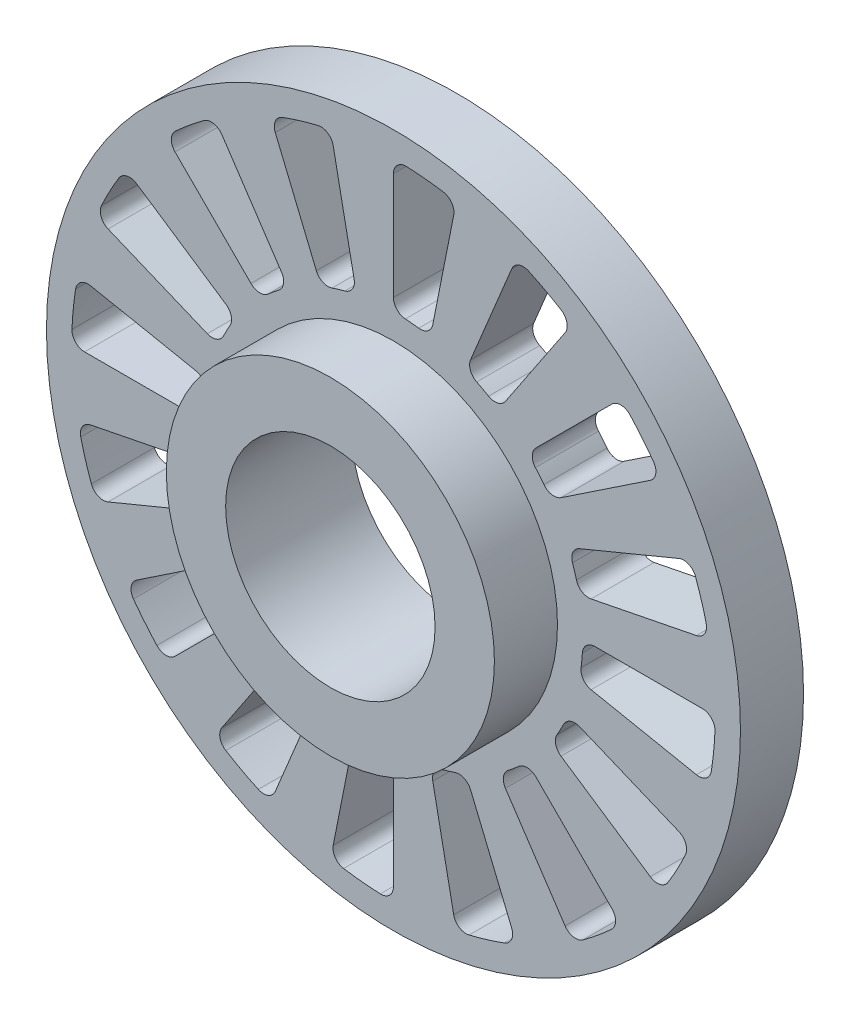
from build123d import *

# Parameters (mm, degrees)
SKETCH1_R                = 13.75
SKETCH1_R_2              = 4.15
BOSS_EXTRUDE1_DEPTH      = 2.5
SKETCH2_R                = 6.5
SKETCH2_R_2              = 4.15
BOSS_EXTRUDE2_DEPTH      = 2.5
CUT_EXTRUDE1_DEPTH       = 21.077973005
FILLET1_R                = 0.5
CIRPATTERN1_COUNT        = 16
FILLET1_OF_CIRPATTERN1_R = 0.5


with BuildPart() as part:
    # Sketch1 → Boss-Extrude1 (new body)
    with BuildSketch(Plane.XY):
        Circle(SKETCH1_R)
        Circle(SKETCH1_R_2, mode=Mode.SUBTRACT)
    extrude(amount=BOSS_EXTRUDE1_DEPTH)

    # Sketch2 → Boss-Extrude2 (add)
    with BuildSketch(Plane.XY.offset(2.5)):
        Circle(SKETCH2_R)
        Circle(SKETCH2_R_2, mode=Mode.SUBTRACT)
    extrude(amount=BOSS_EXTRUDE2_DEPTH)

    # Sketch5 → Cut-Extrude1 (cut, through all)
    with BuildSketch(Plane.XY):
        with BuildLine():
            Line((0, 12.75), (0, 7.5))
            ThreePointArc((0, 7.5), (0.735128552, 7.46388545), (1.463177415, 7.355889603))
            Line((1.463177415, 7.355889603), (2.487401606, 12.505012325))
            ThreePointArc((2.487401606, 12.505012325), (1.249718539, 12.688605265), (0, 12.75))
        make_face()
    cut_extrude1 = extrude(amount=CUT_EXTRUDE1_DEPTH, mode=Mode.SUBTRACT)

    # Fillet1
    fillet1_edges = [part.edges().sort_by_distance(p)[0] for p in [
        (0, 7.5, 1.25),
        (1.463177415, 7.355889603, 1.25),
        (2.487401606, 12.505012325, 1.25),
        (0, 12.75, 1.25),
    ]]
    fillet(fillet1_edges, radius=FILLET1_R)

    # CirPattern1: Cut-Extrude1 ×16 about axis
    cirpattern1_axis = Axis((0, 0, 0), (0, 0, 1))
    for i in range(1, CIRPATTERN1_COUNT):
        add(cut_extrude1.rotate(cirpattern1_axis, i * 360 / CIRPATTERN1_COUNT), mode=Mode.SUBTRACT)

    # Fillet1 of CirPattern1
    fillet1_of_cirpattern1_edges = [part.edges().sort_by_distance(p)[0] for p in [
        (-2.870125743, 6.929096494, 1.25),
        (-1.463177415, 7.355889603, 1.25),
        (-2.487401606, 12.505012325, 1.25),
        (-4.879213763, 11.77946404, 1.25),
        (-5.303300859, 5.303300859, 1.25),
        (-4.166776748, 6.236022092, 1.25),
        (-7.083520471, 10.601237557, 1.25),
        (-9.01561146, 9.01561146, 1.25),
        (-6.929096494, 2.870125743, 1.25),
        (-6.236022092, 4.166776748, 1.25),
        (-10.601237557, 7.083520471, 1.25),
        (-11.77946404, 4.879213763, 1.25),
        (-7.5, 0, 1.25),
        (-7.355889603, 1.463177415, 1.25),
        (-12.505012325, 2.487401606, 1.25),
        (-12.75, 0, 1.25),
        (-6.929096494, -2.870125743, 1.25),
        (-7.355889603, -1.463177415, 1.25),
        (-12.505012325, -2.487401606, 1.25),
        (-11.77946404, -4.879213763, 1.25),
        (-5.303300859, -5.303300859, 1.25),
        (-6.236022092, -4.166776748, 1.25),
        (-10.601237557, -7.083520471, 1.25),
        (-9.01561146, -9.01561146, 1.25),
        (-2.870125743, -6.929096494, 1.25),
        (-4.166776748, -6.236022092, 1.25),
        (-7.083520471, -10.601237557, 1.25),
        (-4.879213763, -11.77946404, 1.25),
        (0, -7.5, 1.25),
        (-1.463177415, -7.355889603, 1.25),
        (-2.487401606, -12.505012325, 1.25),
        (0, -12.75, 1.25),
        (2.870125743, -6.929096494, 1.25),
        (1.463177415, -7.355889603, 1.25),
        (2.487401606, -12.505012325, 1.25),
        (4.879213763, -11.77946404, 1.25),
        (5.303300859, -5.303300859, 1.25),
        (4.166776748, -6.236022092, 1.25),
        (7.083520471, -10.601237557, 1.25),
        (9.01561146, -9.01561146, 1.25),
        (6.929096494, -2.870125743, 1.25),
        (6.236022092, -4.166776748, 1.25),
        (10.601237557, -7.083520471, 1.25),
        (11.77946404, -4.879213763, 1.25),
        (7.5, 0, 1.25),
        (7.355889603, -1.463177415, 1.25),
        (12.505012325, -2.487401606, 1.25),
        (12.75, 0, 1.25),
        (6.929096494, 2.870125743, 1.25),
        (7.355889603, 1.463177415, 1.25),
        (12.505012325, 2.487401606, 1.25),
        (11.77946404, 4.879213763, 1.25),
        (5.303300859, 5.303300859, 1.25),
        (6.236022092, 4.166776748, 1.25),
        (10.601237557, 7.083520471, 1.25),
        (9.01561146, 9.01561146, 1.25),
        (2.870125743, 6.929096494, 1.25),
        (4.166776748, 6.236022092, 1.25),
        (7.083520471, 10.601237557, 1.25),
        (4.879213763, 11.77946404, 1.25),
    ]]
    fillet(fillet1_of_cirpattern1_edges, radius=FILLET1_OF_CIRPATTERN1_R)


solid = part.part
